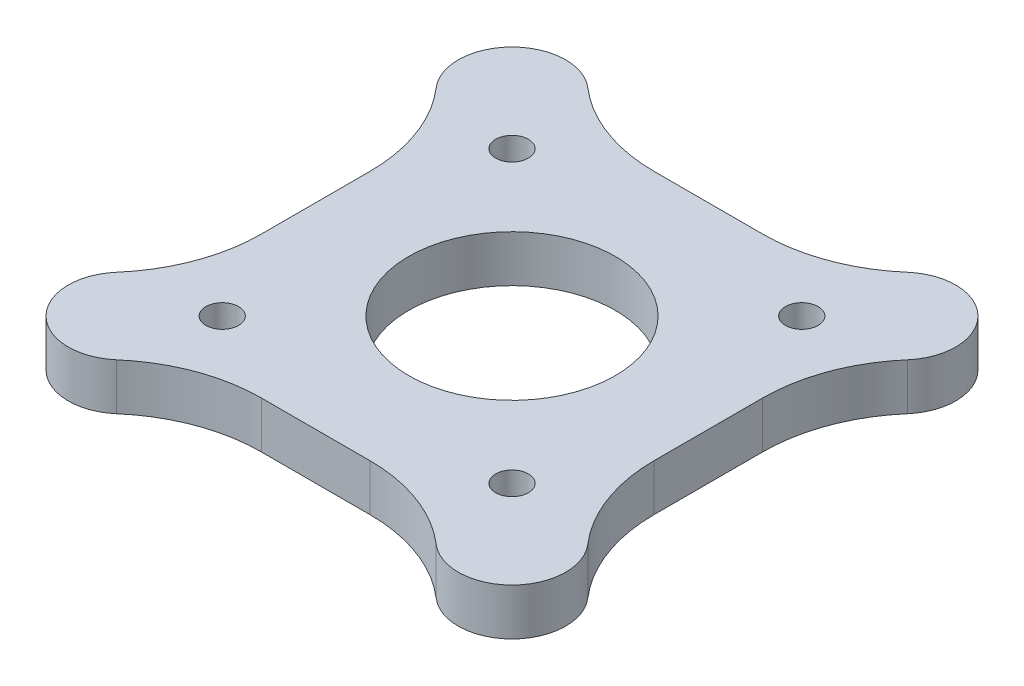
from build123d import *

# Parameters (mm, degrees)
SKETCH_1_W      = 42
SKETCH_1_H      = 42
SKETCH_1_R      = 11.05
SKETCH_1_R_2    = 1.75
EXTRUDE_1_DEPTH = 5
EXTRUDE_2_DEPTH = 5


with BuildPart() as part:
    # 草图1 → 凸台-拉伸1 (new body)
    with BuildSketch(Plane(origin=(0, 0, 0), x_dir=(1, 0, 0), z_dir=(0, 1, 0))):
        Rectangle(SKETCH_1_W, SKETCH_1_H)
        with Locations(Location((0, 0, 0), (0, 0, 270))):
            Circle(SKETCH_1_R, mode=Mode.SUBTRACT)
        with Locations(Location((15.5, 15.5, 0), (0, 0, 270))):
            Circle(SKETCH_1_R_2, mode=Mode.SUBTRACT)
        with Locations(Location((15.5, -15.5, 0), (0, 0, 270))):
            Circle(SKETCH_1_R_2, mode=Mode.SUBTRACT)
        with Locations(Location((-15.5, -15.5, 0), (0, 0, 270))):
            Circle(SKETCH_1_R_2, mode=Mode.SUBTRACT)
        with Locations(Location((-15.5, 15.5, 0), (0, 0, 270))):
            Circle(SKETCH_1_R_2, mode=Mode.SUBTRACT)
    extrude(amount=EXTRUDE_1_DEPTH)

    # 草图2 → 凸台-拉伸2 (add)
    with BuildSketch(Plane(origin=(0, 0, 0), x_dir=(1, 0, 0), z_dir=(0, 1, 0))):
        with BuildLine():
            Line((-5.80218169, -21), (-21, -21))
            Line((-21, -21), (-21, -5.80218169))
            ThreePointArc((-21, -5.80218169), (-22.086185579, -11.829035113), (-25.208061098, -17.097493573))
            ThreePointArc((-25.208061098, -17.097493573), (-24.925514037, -24.925514037), (-17.097493573, -25.208061098))
            ThreePointArc((-17.097493573, -25.208061098), (-11.829035113, -22.086185579), (-5.80218169, -21))
        make_face()
        with BuildLine():
            Line((21, -5.80218169), (21, -21))
            Line((21, -21), (5.80218169, -21))
            ThreePointArc((5.80218169, -21), (11.829035113, -22.086185579), (17.097493573, -25.208061098))
            ThreePointArc((17.097493573, -25.208061098), (24.925514037, -24.925514037), (25.208061098, -17.097493573))
            ThreePointArc((25.208061098, -17.097493573), (22.086185579, -11.829035113), (21, -5.80218169))
        make_face()
        with BuildLine():
            Line((-21, 5.80218169), (-21, 21))
            Line((-21, 21), (-5.80218169, 21))
            ThreePointArc((-5.80218169, 21), (-11.829035113, 22.086185579), (-17.097493573, 25.208061098))
            ThreePointArc((-17.097493573, 25.208061098), (-24.925514037, 24.925514037), (-25.208061098, 17.097493573))
            ThreePointArc((-25.208061098, 17.097493573), (-22.086185579, 11.829035113), (-21, 5.80218169))
        make_face()
        with BuildLine():
            Line((5.80218169, 21), (21, 21))
            Line((21, 21), (21, 5.80218169))
            ThreePointArc((21, 5.80218169), (22.086185579, 11.829035113), (25.208061098, 17.097493573))
            ThreePointArc((25.208061098, 17.097493573), (24.925514037, 24.925514037), (17.097493573, 25.208061098))
            ThreePointArc((17.097493573, 25.208061098), (11.829035113, 22.086185579), (5.80218169, 21))
        make_face()
    extrude(amount=EXTRUDE_2_DEPTH)


solid = part.part
